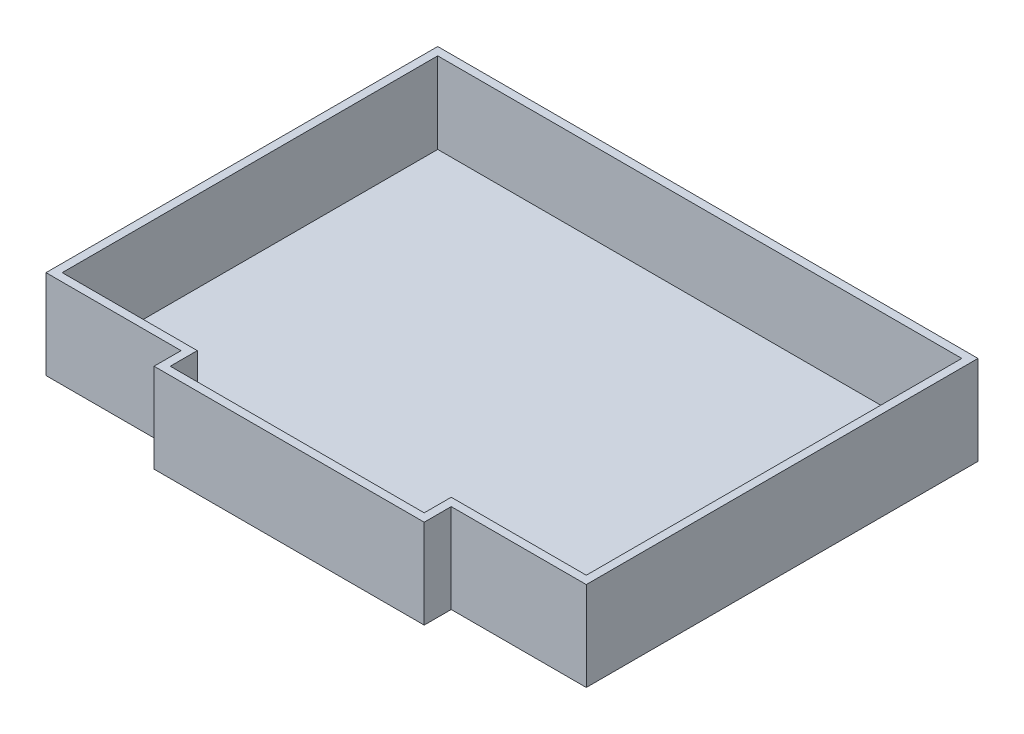
from build123d import *

# Parameters (mm, degrees)
SALIENTE_EXTRUIR1_DEPTH = 3
SALIENTE_EXTRUIR2_DEPTH = 30


with BuildPart() as part:
    # Croquis1 → Saliente-Extruir1 (new body)
    with BuildSketch(Plane(origin=(0, 0, 0), x_dir=(1, 0, 0), z_dir=(0, 1, 0))):
        Polygon((50, 20), (150, 20), (150, 30), (200, 30), (200, 175), (0, 175), (0, 30), (50, 30), align=None)
    extrude(amount=SALIENTE_EXTRUIR1_DEPTH)

    # Croquis2 → Saliente-Extruir2 (add)
    with BuildSketch(Plane(origin=(0, 3, 0), x_dir=(1, 0, 0), z_dir=(0, 1, 0))):
        Polygon((0, 175), (200, 175), (200, 30), (150, 30), (150, 20), (50, 20), (50, 30), (0, 30), align=None)
        Polygon((197, 33), (197, 172), (3, 172), (3, 33), (53, 33), (53, 23), (147, 23), (147, 33), align=None, mode=Mode.SUBTRACT)
    extrude(amount=SALIENTE_EXTRUIR2_DEPTH)


solid = part.part
